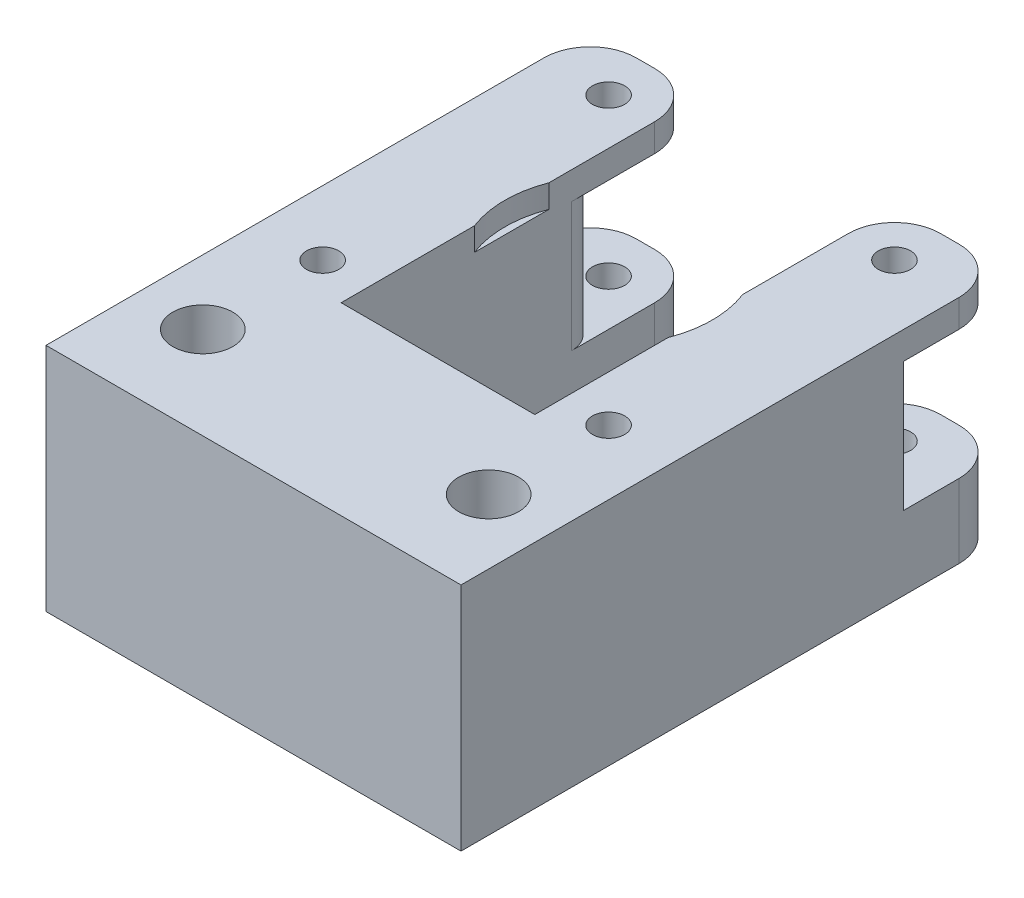
from build123d import *

# Parameters (mm, degrees)
SKETCH1_W                                           = 45
SKETCH1_H                                           = 20
BOSS_EXTRUDE1_DEPTH                                 = 25
SKETCH2_W                                           = 12
SKETCH2_H                                           = 25
BOSS_EXTRUDE2_DEPTH                                 = 40
SKETCH3_R                                           = 1.75
CUT_EXTRUDE1_DEPTH                                  = 61.259853966
SKETCH4_R                                           = 1.75
CUT_EXTRUDE2_DEPTH                                  = 25
CBORE_FOR_M3_HEX_SOCKET_HEAD_CAP_SCREW1_D           = 3.5
CBORE_FOR_M3_HEX_SOCKET_HEAD_CAP_SCREW1_CBORE_D     = 6.5
CBORE_FOR_M3_HEX_SOCKET_HEAD_CAP_SCREW1_CBORE_DEPTH = 11.4
CBORE_FOR_M3_HEX_SOCKET_HEAD_CAP_SCREW2_D           = 3.5
CBORE_FOR_M3_HEX_SOCKET_HEAD_CAP_SCREW2_CBORE_D     = 6.5
CBORE_FOR_M3_HEX_SOCKET_HEAD_CAP_SCREW2_CBORE_DEPTH = 4
CBORE_FOR_M3_PAN_HEAD_SCREW1_D                      = 3.5
CBORE_FOR_M3_PAN_HEAD_SCREW1_CBORE_D                = 6.5
CBORE_FOR_M3_PAN_HEAD_SCREW1_CBORE_DEPTH            = 12.4
CUT_EXTRUDE3_DEPTH                                  = 72.763500472
CUT_EXTRUDE3_DEPTH_BACK                             = 72.763500472
SKETCH9_W                                           = 12
SKETCH9_H                                           = 14
SKETCH10_W                                          = 12
SKETCH10_H                                          = 8
SKETCH10_H_2                                        = 3
CUT_EXTRUDE5_DEPTH                                  = 1
FILLET2_R                                           = 5
FILLET5_R                                           = 3
SKETCH13_R                                          = 11.25
CUT_EXTRUDE6_DEPTH                                  = 2.5


with BuildPart() as part:
    # Sketch1 → Boss-Extrude1 (new body)
    with BuildSketch(Plane(origin=(0, 0, 0), x_dir=(1, 0, 0), z_dir=(0, 1, 0))):
        Rectangle(SKETCH1_W, SKETCH1_H)
    extrude(amount=BOSS_EXTRUDE1_DEPTH)

    # Sketch2 → Boss-Extrude2 (add)
    with BuildSketch(Plane(origin=(0, 0, -10), x_dir=(-1, 0, 0), z_dir=(0, 0, -1))):
        with Locations((-16.5, 12.5)):
            Rectangle(SKETCH2_W, SKETCH2_H)
        with Locations((16.5, 12.5)):
            Rectangle(SKETCH2_W, SKETCH2_H)
    extrude(amount=BOSS_EXTRUDE2_DEPTH)

    # Sketch3 → Cut-Extrude1 (cut, through all)
    with BuildSketch(Plane(origin=(0, 25, 0), x_dir=(1, 0, 0), z_dir=(0, 1, 0))):
        with Locations(Location((15.5, 44, 0), (0, 0, 270))):
            Circle(SKETCH3_R)
        with Locations(Location((15.5, 13, 0), (0, 0, 270))):
            Circle(SKETCH3_R)
        with Locations(Location((-15.5, 13, 0), (0, 0, 270))):
            Circle(SKETCH3_R)
        with Locations(Location((-15.5, 44, 0), (0, 0, 270))):
            Circle(SKETCH3_R)
    extrude(amount=-CUT_EXTRUDE1_DEPTH, mode=Mode.SUBTRACT)

    # Sketch4 → Cut-Extrude2 (cut)
    with BuildSketch(Plane(origin=(0, 25, 0), x_dir=(1, 0, 0), z_dir=(0, 1, 0))):
        with Locations(Location((-15.5, 0, 0), (0, 0, 270))):
            Circle(SKETCH4_R)
        with Locations(Location((15.5, 0, 0), (0, 0, 270))):
            Circle(SKETCH4_R)
    extrude(amount=-CUT_EXTRUDE2_DEPTH, mode=Mode.SUBTRACT)

    # CBORE for M3 Hex Socket Head Cap Screw1 (through all)
    with Locations(Plane(origin=(0, 25, 0), x_dir=(1, 0, 0), z_dir=(0, 1, 0))):
        with Locations((15.5, 0), (-15.5, 0)):
            CounterBoreHole(CBORE_FOR_M3_HEX_SOCKET_HEAD_CAP_SCREW1_D / 2, CBORE_FOR_M3_HEX_SOCKET_HEAD_CAP_SCREW1_CBORE_D / 2, CBORE_FOR_M3_HEX_SOCKET_HEAD_CAP_SCREW1_CBORE_DEPTH)

    # CBORE for M3 Hex Socket Head Cap Screw2 (through all)
    with Locations(Plane(origin=(0, 0, 0), x_dir=(-1, 0, 0), z_dir=(0, -1, 0))):
        with Locations((15.5, 44), (15.5, 13), (-15.5, 13), (-15.5, 44)):
            CounterBoreHole(CBORE_FOR_M3_HEX_SOCKET_HEAD_CAP_SCREW2_D / 2, CBORE_FOR_M3_HEX_SOCKET_HEAD_CAP_SCREW2_CBORE_D / 2, CBORE_FOR_M3_HEX_SOCKET_HEAD_CAP_SCREW2_CBORE_DEPTH)

    # CBORE for M3 Pan Head Screw1 (through all)
    with Locations(Plane(origin=(0, 0, 0), x_dir=(-1, 0, 0), z_dir=(0, -1, 0))):
        with Locations((-15.5, 13), (15.5, 13)):
            CounterBoreHole(CBORE_FOR_M3_PAN_HEAD_SCREW1_D / 2, CBORE_FOR_M3_PAN_HEAD_SCREW1_CBORE_D / 2, CBORE_FOR_M3_PAN_HEAD_SCREW1_CBORE_DEPTH)

    # Sketch9 → Cut-Extrude3 (cut, two sides: drawn at the far end of the back side and taken through both)
    with BuildSketch(Plane(origin=(22.5, 0, 0), x_dir=(0, 0, -1), z_dir=(1, 0, 0)).offset(-CUT_EXTRUDE3_DEPTH_BACK)):
        with Locations((44, 15)):
            Rectangle(SKETCH9_W, SKETCH9_H)
    extrude(amount=CUT_EXTRUDE3_DEPTH + CUT_EXTRUDE3_DEPTH_BACK, mode=Mode.SUBTRACT)

    # Sketch10 → Cut-Extrude5 (cut)
    with BuildSketch(Plane(origin=(0, 0, -50), x_dir=(-1, 0, 0), z_dir=(0, 0, -1))):
        with Locations((-16.5, 4)):
            Rectangle(SKETCH10_W, SKETCH10_H)
        with Locations((16.5, 4)):
            Rectangle(SKETCH10_W, SKETCH10_H)
        with Locations((-16.5, 23.5)):
            Rectangle(SKETCH10_W, SKETCH10_H_2)
        with Locations((16.5, 23.5)):
            Rectangle(SKETCH10_W, SKETCH10_H_2)
    extrude(amount=-CUT_EXTRUDE5_DEPTH, mode=Mode.SUBTRACT)

    # Fillet2
    fillet2_edges = [part.edges().sort_by_distance(p)[0] for p in [
        (-10.5, 4, -49),
        (-22.5, 4, -49),
        (22.5, 23.5, -49),
        (10.5, 23.5, -49),
        (-10.5, 23.5, -49),
        (-22.5, 23.5, -49),
        (22.5, 4, -49),
        (10.5, 4, -49),
    ]]
    fillet(fillet2_edges, radius=FILLET2_R)

    # Fillet5
    fillet5_edges = [part.edges().sort_by_distance(p)[0] for p in [
        (-10.5, 15, -38),
        (10.5, 15, -38),
    ]]
    fillet(fillet5_edges, radius=FILLET5_R)

    # Sketch13 → Cut-Extrude6 (cut)
    with BuildSketch(Plane(origin=(0, 25, 0), x_dir=(1, 0, 0), z_dir=(0, 1, 0))):
        with Locations((0, 28.5)):
            Circle(SKETCH13_R)
    extrude(amount=-CUT_EXTRUDE6_DEPTH, mode=Mode.SUBTRACT)


solid = part.part
